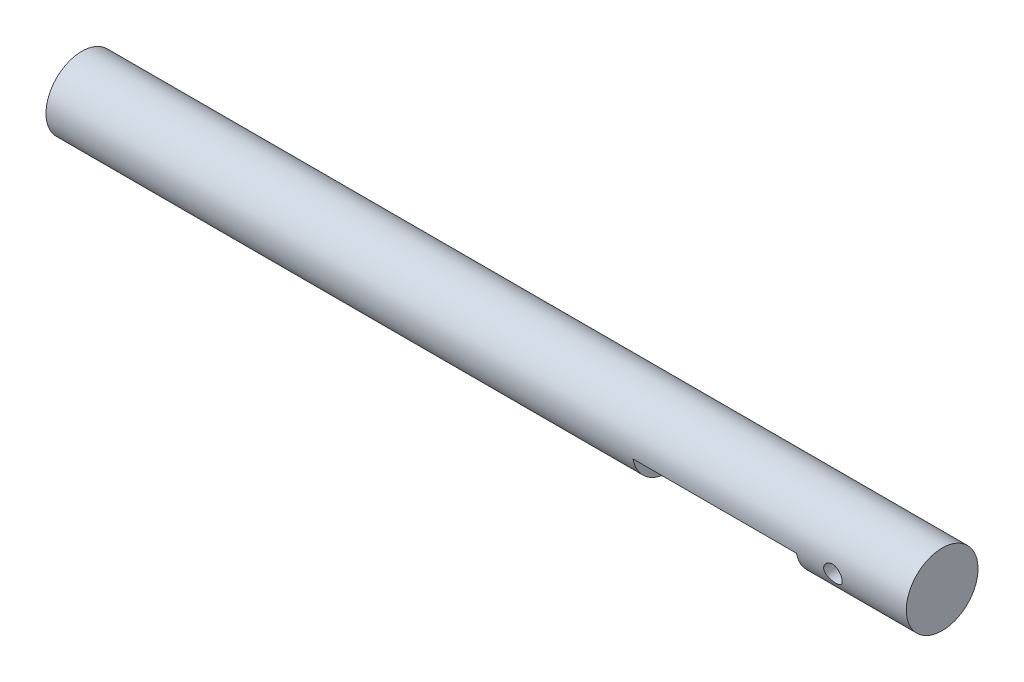
from build123d import *

# Parameters (mm, degrees)
SKETCH1_R                = 1
SKETCH1_R_2              = 0.5
BOSS_EXTRUDE1_DEPTH      = 1.5
SKETCH2_W                = 5.75
SKETCH2_H                = 4
CUT_EXTRUDE1_DEPTH       = 1
BOSS_EXTRUDE2_DEPTH      = 25
BOSS_EXTRUDE2_DEPTH_BACK = 125
BOSS_EXTRUDE2_START      = 8.5
SKETCH5_R                = 6.25
SKETCH6_W                = 28.5
SKETCH6_H                = 12.5
CUT_EXTRUDE2_DEPTH       = 25
SKETCH7_R                = 1.25
CUT_EXTRUDE3_DEPTH       = 3.175
CUT_EXTRUDE4_REACH       = 119.335
CUT_EXTRUDE4_END_RADIUS  = 6.25
SKETCH8_R                = 1.5875


with BuildPart() as part:
    # Sketch1 → Boss-Extrude1 (new, symmetric)
    with BuildSketch(Plane.XY):
        Polygon((-8.5, -19.85), (-8.5, 0), (8.5, 0), (8.5, -19.85), (14.25, -19.85), (14.25, 10), (-14.25, 10), (-14.25, -19.85), align=None)
        with Locations((-7.5, 5)):
            Circle(SKETCH1_R, mode=Mode.SUBTRACT)
        with Locations((7.5, 5)):
            Circle(SKETCH1_R, mode=Mode.SUBTRACT)
        with Locations((-11.375, -17.35)):
            Circle(SKETCH1_R_2, mode=Mode.SUBTRACT)
        with Locations((11.375, -17.35)):
            Circle(SKETCH1_R_2, mode=Mode.SUBTRACT)
    extrude(amount=BOSS_EXTRUDE1_DEPTH, both=True)

    # Sketch2 → Cut-Extrude1 (cut)
    with BuildSketch(Plane.XY.offset(1.5)):
        with Locations((-11.375, -17.85)):
            Rectangle(SKETCH2_W, SKETCH2_H)
        with Locations((11.375, -17.85)):
            Rectangle(SKETCH2_W, SKETCH2_H)
    extrude(amount=-CUT_EXTRUDE1_DEPTH, mode=Mode.SUBTRACT)

    # Sketch5 → Boss-Extrude2 (add, two sides: drawn at the far end of the back side and taken through both)
    with BuildSketch(Plane(origin=(0, 0, 0), x_dir=(0, 0, -1), z_dir=(1, 0, 0)).offset(BOSS_EXTRUDE2_START - BOSS_EXTRUDE2_DEPTH_BACK)):
        with Locations(Location((0, 6.25, 0), (0, 0, 270))):
            Circle(SKETCH5_R)
    extrude(amount=BOSS_EXTRUDE2_DEPTH + BOSS_EXTRUDE2_DEPTH_BACK)

    # Sketch6 → Cut-Extrude2 (cut)
    with BuildSketch(Plane.XZ.offset(19.85)):
        Rectangle(SKETCH6_W, SKETCH6_H)
    extrude(amount=-CUT_EXTRUDE2_DEPTH, mode=Mode.SUBTRACT)

    # Sketch7 → Cut-Extrude3 (cut)
    with BuildSketch(Plane(origin=(0, 5.15, 0), x_dir=(-1, 0, 0), z_dir=(0, -1, 0))):
        with Locations(Location((7.5, 0, 0), (0, 0, 180))):
            Circle(SKETCH7_R)
        with Locations(Location((-7.5, 0, 0), (0, 0, 180))):
            Circle(SKETCH7_R)
    extrude(amount=-CUT_EXTRUDE3_DEPTH, mode=Mode.SUBTRACT)

    # Cut-Extrude4: up to this cylinder (the profile starts inside it)
    cut_extrude4_end = Plane(origin=(20.6, 6.25, 0), z_dir=(-1, 0, 0)) * Cylinder(CUT_EXTRUDE4_END_RADIUS, 252.17, mode=Mode.PRIVATE)
    # Sketch8 → Cut-Extrude4 (cut, up to the surface)
    with BuildSketch(Plane.XY, mode=Mode.PRIVATE) as cut_extrude4_sk1:
        with Locations(Location((20.6, 5.15, 0), (0, 0, 180))):
            Circle(SKETCH8_R)
    cut_extrude4_tool1 = extrude(cut_extrude4_sk1.sketch, amount=CUT_EXTRUDE4_REACH, mode=Mode.PRIVATE) & cut_extrude4_end
    add(cut_extrude4_tool1.solids().sort_by_distance((20.6, 5.15, 0))[0], mode=Mode.SUBTRACT)


solid = part.part
